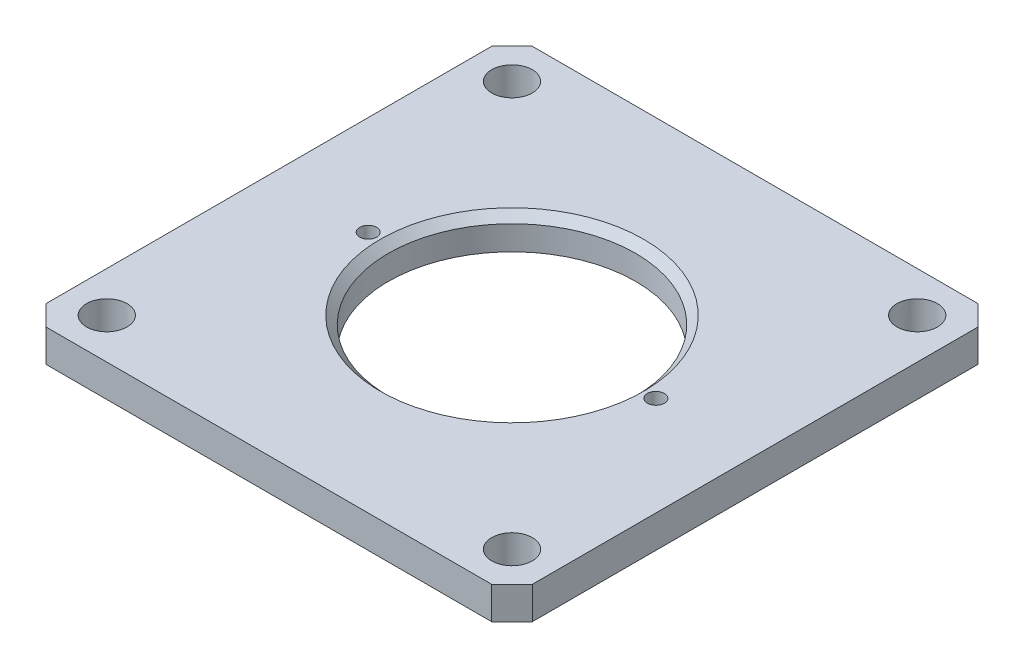
from build123d import *

# Parameters (mm, degrees)
SKETCH1_W           = 120
SKETCH1_H           = 120
BOSS_EXTRUDE1_DEPTH = 8
CUT_EXTRUDE1_REACH  = 87.229
SKETCH2_R           = 30.5
CHAMFER1_SIZE       = 2
CUT_EXTRUDE2_REACH  = 87.229
SKETCH3_R           = 5
CHAMFER2_SIZE       = 5
M5_TAPPED_HOLE1_D   = 4.2


with BuildPart() as part:
    # Sketch1 → Boss-Extrude1 (new body)
    with BuildSketch(Plane(origin=(0, 0, 0), x_dir=(1, 0, 0), z_dir=(0, 1, 0))):
        Rectangle(SKETCH1_W, SKETCH1_H)
    extrude(amount=BOSS_EXTRUDE1_DEPTH)

    # Sketch2 → Cut-Extrude1 (cut, up to next)
    with BuildSketch(Plane(origin=(0, 8, 0), x_dir=(1, 0, 0), z_dir=(0, 1, 0)), mode=Mode.PRIVATE) as cut_extrude1_sk1:
        with Locations(Location((0, 0, 0), (0, 0, 270))):
            Circle(SKETCH2_R)
    cut_extrude1_tool1 = extrude(cut_extrude1_sk1.sketch, amount=-CUT_EXTRUDE1_REACH, mode=Mode.PRIVATE) & part.part
    add(cut_extrude1_tool1.solids().sort_by_distance((0, 8, 0))[0], mode=Mode.SUBTRACT)

    # Chamfer1
    chamfer1_edges = [part.edges().sort_by_distance(p)[0] for p in [
        (0, 8, -30.5),
    ]]
    chamfer(chamfer1_edges, length=CHAMFER1_SIZE)

    # Sketch3 → Cut-Extrude2 (cut, up to next)
    with BuildSketch(Plane(origin=(0, 8, 0), x_dir=(1, 0, 0), z_dir=(0, 1, 0)), mode=Mode.PRIVATE) as cut_extrude2_sk1:
        with Locations(Location((-50, 50, 0), (0, 0, 270))):
            Circle(SKETCH3_R)
    cut_extrude2_tool1 = extrude(cut_extrude2_sk1.sketch, amount=-CUT_EXTRUDE2_REACH, mode=Mode.PRIVATE) & part.part
    # Sketch3 → Cut-Extrude2 (cut, up to next)
    with BuildSketch(Plane(origin=(0, 8, 0), x_dir=(1, 0, 0), z_dir=(0, 1, 0)), mode=Mode.PRIVATE) as cut_extrude2_sk2:
        with Locations(Location((50, 50, 0), (0, 0, 270))):
            Circle(SKETCH3_R)
    cut_extrude2_tool2 = extrude(cut_extrude2_sk2.sketch, amount=-CUT_EXTRUDE2_REACH, mode=Mode.PRIVATE) & part.part
    # Sketch3 → Cut-Extrude2 (cut, up to next)
    with BuildSketch(Plane(origin=(0, 8, 0), x_dir=(1, 0, 0), z_dir=(0, 1, 0)), mode=Mode.PRIVATE) as cut_extrude2_sk3:
        with Locations(Location((-50, -50, 0), (0, 0, 270))):
            Circle(SKETCH3_R)
    cut_extrude2_tool3 = extrude(cut_extrude2_sk3.sketch, amount=-CUT_EXTRUDE2_REACH, mode=Mode.PRIVATE) & part.part
    # Sketch3 → Cut-Extrude2 (cut, up to next)
    with BuildSketch(Plane(origin=(0, 8, 0), x_dir=(1, 0, 0), z_dir=(0, 1, 0)), mode=Mode.PRIVATE) as cut_extrude2_sk4:
        with Locations(Location((50, -50, 0), (0, 0, 270))):
            Circle(SKETCH3_R)
    cut_extrude2_tool4 = extrude(cut_extrude2_sk4.sketch, amount=-CUT_EXTRUDE2_REACH, mode=Mode.PRIVATE) & part.part
    add(cut_extrude2_tool1.solids().sort_by_distance((-50, 8, -50))[0], mode=Mode.SUBTRACT)
    add(cut_extrude2_tool2.solids().sort_by_distance((50, 8, -50))[0], mode=Mode.SUBTRACT)
    add(cut_extrude2_tool3.solids().sort_by_distance((-50, 8, 50))[0], mode=Mode.SUBTRACT)
    add(cut_extrude2_tool4.solids().sort_by_distance((50, 8, 50))[0], mode=Mode.SUBTRACT)

    # Chamfer2
    chamfer2_edges = [part.edges().sort_by_distance(p)[0] for p in [
        (-60, 4, -60),
        (60, 4, -60),
        (60, 4, 60),
        (-60, 4, 60),
    ]]
    chamfer(chamfer2_edges, length=CHAMFER2_SIZE)

    # M5 Tapped Hole1 (through all)
    with Locations(Plane(origin=(0, 8, 0), x_dir=(1, 0, 0), z_dir=(0, 1, 0))):
        with Locations((-35.5, 0), (35.5, 0)):
            Hole(M5_TAPPED_HOLE1_D / 2)


solid = part.part
